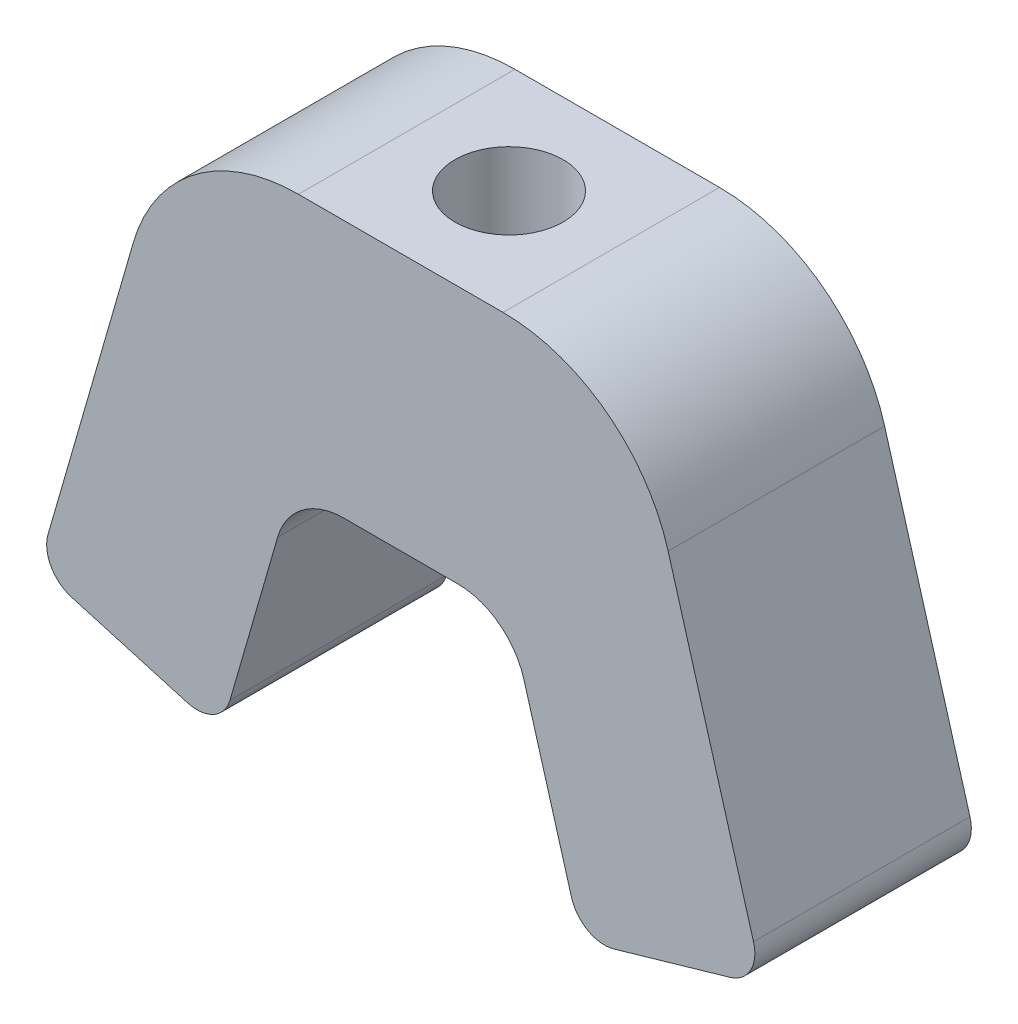
from build123d import *

# Parameters (mm, degrees)
BOSS_EXTRUDE1_DEPTH                 = 8
FILLET1_R                           = 6.35
FILLET2_R                           = 2.54
FILLET3_R                           = 1.27
F_8_32_TAPPED_HOLE3_D               = 4
F_8_32_TAPPED_HOLE3_DEPTH           = 10.70864
F_8_32_TAPPED_HOLE3_TIP             = 1.201721238
F_8_32_TAPPED_HOLE3_ON_FACE_2_D     = 4
F_8_32_TAPPED_HOLE3_ON_FACE_2_DEPTH = 10.70864
F_8_32_TAPPED_HOLE3_ON_FACE_2_TIP   = 1.201721238
F_8_32_TAPPED_HOLE3_ON_FACE_3_D     = 4
F_8_32_TAPPED_HOLE3_ON_FACE_3_DEPTH = 10.70864
F_8_32_TAPPED_HOLE3_ON_FACE_3_TIP   = 1.201721238


with BuildPart() as part:
    # Sketch1 → Boss-Extrude1 (new body)
    with BuildSketch(Plane.XY):
        Polygon((-13.387780392, -33.75253802), (-6.662467427, -35.694229428), (-4.020380191, -26.543), (4.020380191, -26.543), (6.662467427, -35.694229428), (13.387780392, -33.75253802), (8.556286476, -17.018), (-8.556286476, -17.018), align=None)
    extrude(amount=BOSS_EXTRUDE1_DEPTH)

    # Fillet1
    fillet1_edges = [part.edges().sort_by_distance(p)[0] for p in [
        (-8.556286476, -17.018, 4),
        (8.556286476, -17.018, 4),
    ]]
    fillet(fillet1_edges, radius=FILLET1_R)

    # Fillet2
    fillet2_edges = [part.edges().sort_by_distance(p)[0] for p in [
        (4.020380191, -26.543, 4),
        (-4.020380191, -26.543, 4),
    ]]
    fillet(fillet2_edges, radius=FILLET2_R)

    # Fillet3
    fillet3_edges = [part.edges().sort_by_distance(p)[0] for p in [
        (-6.662467427, -35.694229428, 4),
        (-13.387780392, -33.75253802, 4),
        (13.387780392, -33.75253802, 4),
        (6.662467427, -35.694229428, 4),
    ]]
    fillet(fillet3_edges, radius=FILLET3_R)

    # #8-32 Tapped Hole3
    with Locations(Plane(origin=(-10.02512391, -34.723383724, 4), x_dir=(-0.960758995019, 0.277384486751, 0), z_dir=(-0.277384486751, -0.960758995019, 0))):
        with Locations((0, 0)):
            Hole(F_8_32_TAPPED_HOLE3_D / 2, depth=F_8_32_TAPPED_HOLE3_DEPTH)
            with Locations((0, 0, -(F_8_32_TAPPED_HOLE3_DEPTH + F_8_32_TAPPED_HOLE3_TIP / 2))):  # 118° drill point
                Cone(0, F_8_32_TAPPED_HOLE3_D / 2, F_8_32_TAPPED_HOLE3_TIP, mode=Mode.SUBTRACT)

    # #8-32 Tapped Hole3 on face 2
    with Locations(Plane(origin=(10.02512391, -34.723383724, 4), x_dir=(-0.960759125121, -0.277384036124, 0), z_dir=(0.277384036124, -0.960759125121, 0))):
        with Locations((0, 0)):
            Hole(F_8_32_TAPPED_HOLE3_ON_FACE_2_D / 2, depth=F_8_32_TAPPED_HOLE3_ON_FACE_2_DEPTH)
            with Locations((0, 0, -(F_8_32_TAPPED_HOLE3_ON_FACE_2_DEPTH + F_8_32_TAPPED_HOLE3_ON_FACE_2_TIP / 2))):  # 118° drill point
                Cone(0, F_8_32_TAPPED_HOLE3_ON_FACE_2_D / 2, F_8_32_TAPPED_HOLE3_ON_FACE_2_TIP, mode=Mode.SUBTRACT)

    # #8-32 Tapped Hole3 on face 3
    with Locations(Plane(origin=(0, -17.018, 4), x_dir=(0, 0, 1), z_dir=(0, 1, 0))):
        with Locations((0, 0)):
            Hole(F_8_32_TAPPED_HOLE3_ON_FACE_3_D / 2, depth=F_8_32_TAPPED_HOLE3_ON_FACE_3_DEPTH)
            with Locations((0, 0, -(F_8_32_TAPPED_HOLE3_ON_FACE_3_DEPTH + F_8_32_TAPPED_HOLE3_ON_FACE_3_TIP / 2))):  # 118° drill point
                Cone(0, F_8_32_TAPPED_HOLE3_ON_FACE_3_D / 2, F_8_32_TAPPED_HOLE3_ON_FACE_3_TIP, mode=Mode.SUBTRACT)


solid = part.part
